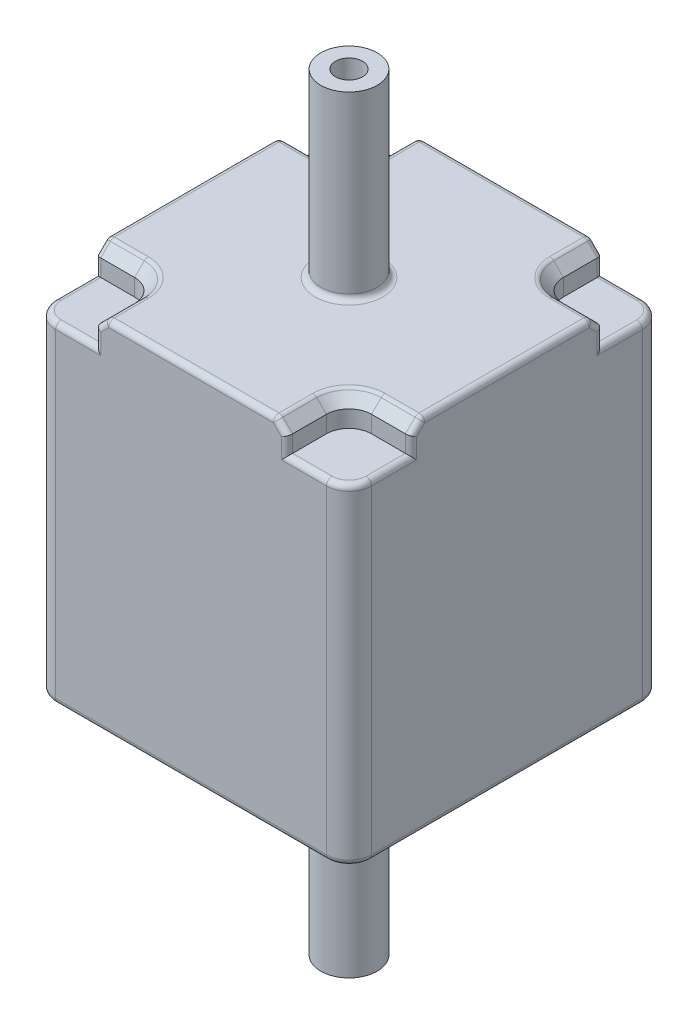
from build123d import *

# Parameters (mm, degrees)
SKETCH_1_W          = 28
SKETCH_1_H          = 28
EXTRUDE_1_DEPTH     = 31.8
SKETCH_2_R          = 10.975
EXTRUDE_2_DEPTH     = 2
SKETCH_3_R          = 2.5
EXTRUDE_3_DEPTH     = 18.2
EXTRUDE_START       = 16
SKETCH_4_R          = 2.5
EXTRUDE_4_DEPTH     = 16
FILLET_1_R          = 2
SKETCH_5_R          = 1.25
CUT_EXTRUDE_1_DEPTH = 5
CUT_EXTRUDE_2_DEPTH = 2.5
CHAMFER_1_SIZE      = 1
FILLET_2_R          = 0.5
SKETCH_7_R          = 1.2
CUT_EXTRUDE_3_DEPTH = 71.823724858


with BuildPart() as part:
    # 草图1 → 凸台-拉伸1 (new body)
    with BuildSketch(Plane(origin=(0, 0, 0), x_dir=(1, 0, 0), z_dir=(0, 1, 0))):
        Rectangle(SKETCH_1_W, SKETCH_1_H)
    extrude(amount=EXTRUDE_1_DEPTH)

    # 草图2 → 凸台-拉伸2 (add)
    with BuildSketch(Plane(origin=(0, 0, 0), x_dir=(-1, 0, 0), z_dir=(0, -1, 0))):
        with Locations(Location((0, 0, 0), (0, 0, 90))):
            Circle(SKETCH_2_R)
    extrude(amount=EXTRUDE_2_DEPTH)

    # 草图3 → 凸台-拉伸3 (add)
    with BuildSketch(Plane.XZ.offset(2)):
        with Locations(Location((0, 0, 0), (0, 0, 270))):
            Circle(SKETCH_3_R)
    extrude(amount=EXTRUDE_3_DEPTH)

    # 草图4 → 凸台-拉伸4 (add)
    with BuildSketch(Plane(origin=(0, 31.8, 0), x_dir=(1, 0, 0), z_dir=(0, 1, 0)).offset(EXTRUDE_START)):
        with Locations(Location((0, 0, 0), (0, 0, 90))):
            Circle(SKETCH_4_R)
    extrude(amount=-EXTRUDE_4_DEPTH)

    # 圆角1
    fillet_1_edges = [part.edges().sort_by_distance(p)[0] for p in [
        (-14, 15.9, -14),
        (14, 15.9, -14),
        (14, 15.9, 14),
        (-14, 15.9, 14),
    ]]
    fillet(fillet_1_edges, radius=FILLET_1_R)

    # 草图5 → 切除-拉伸1 (cut)
    with BuildSketch(Plane.XZ):
        with Locations(Location((-11.5, 11.5, 0), (0, 0, 270))):
            Circle(SKETCH_5_R)
        with Locations(Location((11.5, 11.5, 0), (0, 0, 270))):
            Circle(SKETCH_5_R)
        with Locations(Location((11.5, -11.5, 0), (0, 0, 270))):
            Circle(SKETCH_5_R)
        with Locations(Location((-11.5, -11.5, 0), (0, 0, 270))):
            Circle(SKETCH_5_R)
    extrude(amount=-CUT_EXTRUDE_1_DEPTH, mode=Mode.SUBTRACT)

    # 草图6 → 切除-拉伸2 (cut)
    with BuildSketch(Plane(origin=(0, 31.8, 0), x_dir=(1, 0, 0), z_dir=(0, 1, 0))):
        with BuildLine():
            Line((-14, -8.5), (-10.5, -8.5))
            ThreePointArc((-10.5, -8.5), (-9.085786438, -9.085786438), (-8.5, -10.5))
            Line((-8.5, -10.5), (-8.5, -14))
            Line((-8.5, -14), (-14, -14))
            Line((-14, -14), (-14, -8.5))
        make_face()
        with BuildLine():
            Line((14, 8.5), (10.5, 8.5))
            ThreePointArc((10.5, 8.5), (9.085786438, 9.085786438), (8.5, 10.5))
            Line((8.5, 10.5), (8.5, 14))
            Line((8.5, 14), (14, 14))
            Line((14, 14), (14, 8.5))
        make_face()
        with BuildLine():
            Line((-8.5, 14), (-14, 14))
            Line((-14, 14), (-14, 8.5))
            Line((-14, 8.5), (-10.5, 8.5))
            ThreePointArc((-10.5, 8.5), (-9.085786438, 9.085786438), (-8.5, 10.5))
            Line((-8.5, 10.5), (-8.5, 14))
        make_face()
        with BuildLine():
            Line((14, -8.5), (10.5, -8.5))
            ThreePointArc((10.5, -8.5), (9.085786438, -9.085786438), (8.5, -10.5))
            Line((8.5, -10.5), (8.5, -14))
            Line((8.5, -14), (14, -14))
            Line((14, -14), (14, -8.5))
        make_face()
    extrude(amount=-CUT_EXTRUDE_2_DEPTH, mode=Mode.SUBTRACT)

    # 倒角1
    chamfer_1_edges = [part.edges().sort_by_distance(p)[0] for p in [
        (-12.25, 31.8, -8.5),
        (-9.085786438, 31.8, -9.085786438),
        (-8.5, 31.8, -12.25),
        (8.5, 31.8, -12.25),
        (9.085786438, 31.8, -9.085786438),
        (12.25, 31.8, -8.5),
        (-8.5, 31.8, 12.25),
        (-9.085786438, 31.8, 9.085786438),
        (-12.25, 31.8, 8.5),
        (12.25, 31.8, 8.5),
        (9.085786438, 31.8, 9.085786438),
        (8.5, 31.8, 12.25),
    ]]
    chamfer(chamfer_1_edges, length=CHAMFER_1_SIZE)

    # 圆角2
    fillet_2_edges = [part.edges().sort_by_distance(p)[0] for p in [
        (-10.25, 29.3, -14),
        (-8.5, 30.05, -14),
        (-14, 29.3, -10.25),
        (-14, 30.05, -8.5),
        (14, 29.3, -10.25),
        (14, 30.05, -8.5),
        (10.25, 29.3, -14),
        (8.5, 30.05, -14),
        (-14, 29.3, 10.25),
        (-14, 30.05, 8.5),
        (-10.25, 29.3, 14),
        (-8.5, 30.05, 14),
        (14, 31.8, 0),
        (0, 31.8, -14),
        (-14, 31.8, 0),
        (0, 31.8, 14),
        (-7.5, 31.8, -12.25),
        (-8.378679656, 31.8, -8.378679656),
        (-12.25, 31.8, -7.5),
        (-8.378679656, 31.8, 8.378679656),
        (-12.25, 31.8, 7.5),
        (-7.5, 31.8, 12.25),
        (8.378679656, 31.8, -8.378679656),
        (12.25, 31.8, -7.5),
        (7.5, 31.8, -12.25),
        (8.378679656, 31.8, 8.378679656),
        (7.5, 31.8, 12.25),
        (12.25, 31.8, 7.5),
        (14, 31.3, -8),
        (14, 31.3, 8),
        (-8, 31.3, 14),
        (8, 31.3, 14),
        (-8, 31.3, -14),
        (8, 31.3, -14),
        (-14, 31.3, -8),
        (-14, 31.3, 8),
        (0, 31.8, 2.5),
        (0, 0, -14),
        (-14, 0, 0),
        (14, 0, 0),
        (0, 0, 14),
        (-13.414213562, 0, 13.414213562),
        (-13.414213562, 0, -13.414213562),
        (13.414213562, 0, 13.414213562),
        (13.414213562, 0, -13.414213562),
        (-13.414213562, 29.3, 13.414213562),
        (-13.414213562, 29.3, -13.414213562),
        (13.414213562, 29.3, 13.414213562),
        (13.414213562, 29.3, -13.414213562),
        (10.25, 29.3, 14),
        (14, 29.3, 10.25),
        (14, 30.05, 8.5),
        (8.5, 30.05, 14),
    ]]
    fillet(fillet_2_edges, radius=FILLET_2_R)

    # 草图7 → 切除-拉伸3 (cut, through all)
    with BuildSketch(Plane(origin=(0, 47.8, 0), x_dir=(1, 0, 0), z_dir=(0, 1, 0))):
        with Locations(Location((0, 0, 0), (0, 0, 270))):
            Circle(SKETCH_7_R)
    extrude(amount=-CUT_EXTRUDE_3_DEPTH, mode=Mode.SUBTRACT)


solid = part.part
